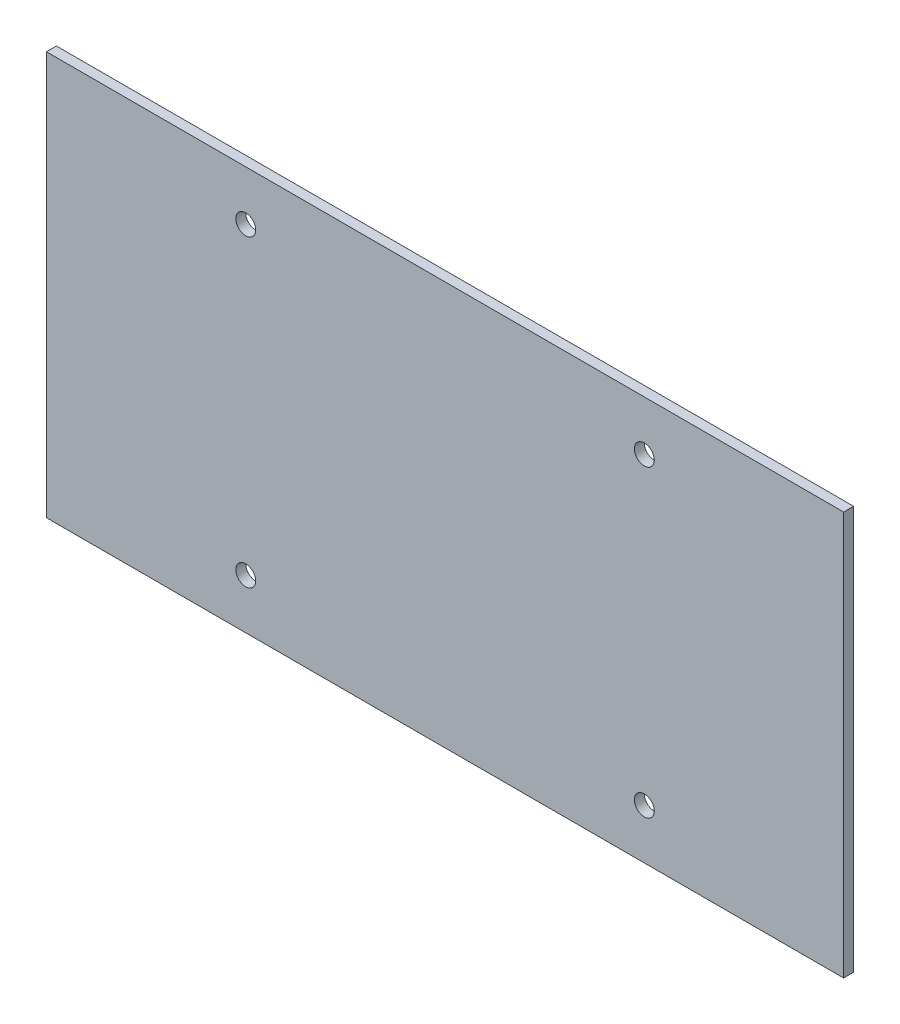
from build123d import *

# Parameters (mm, degrees)
IZIM1_W                     = 160
IZIM1_H                     = 81
IZIM1_R                     = 2
Y_KSEKLIK_EKSTR_ZYON1_DEPTH = 2


with BuildPart() as part:
    # Çizim1 → Yükseklik-Ekstrüzyon1 (new body)
    with BuildSketch(Plane.XY):
        with Locations((80, 40.5)):
            Rectangle(IZIM1_W, IZIM1_H)
        with Locations((40, 71)):
            Circle(IZIM1_R, mode=Mode.SUBTRACT)
        with Locations((120, 71)):
            Circle(IZIM1_R, mode=Mode.SUBTRACT)
        with Locations((40, 10)):
            Circle(IZIM1_R, mode=Mode.SUBTRACT)
        with Locations((120, 10)):
            Circle(IZIM1_R, mode=Mode.SUBTRACT)
    extrude(amount=Y_KSEKLIK_EKSTR_ZYON1_DEPTH)


solid = part.part
